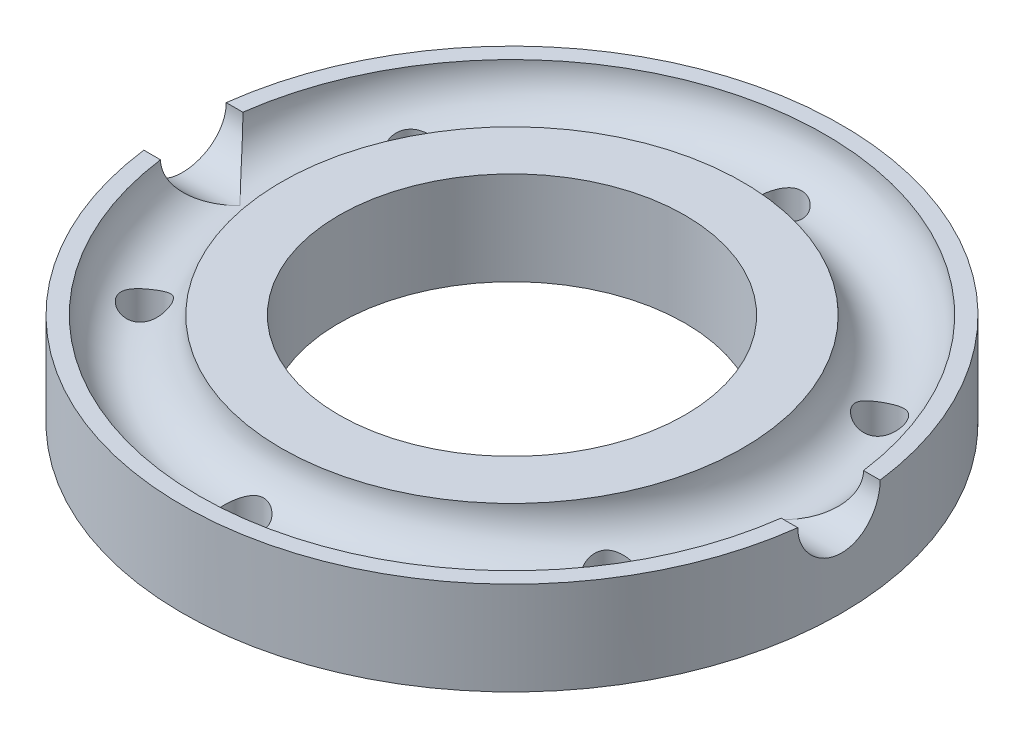
from build123d import *

# Parameters (mm, degrees)
SKETCH1_R           = 10.414
SKETCH1_R_2         = 8.001
BOSS_EXTRUDE1_DEPTH = 4.318
BOSS_EXTRUDE2_START = 4.318
SKETCH2_R           = 15.24
SKETCH2_R_2         = 8.001
BOSS_EXTRUDE2_DEPTH = 4.318
SKETCH3_R           = 1.905
CUT_EXTRUDE1_REACH  = 23.981
SKETCH4_R           = 0.9525
CIRPATTERN1_COUNT   = 6
CUT_EXTRUDE2_START  = -4.318
SKETCH5_R           = 10.414
CUT_EXTRUDE2_DEPTH  = 4.318
CUT_EXTRUDE3_REACH  = 36.35
SKETCH8_R           = 1.905
CIRPATTERN2_COUNT   = 2


with BuildPart() as part:
    # Sketch1 → Boss-Extrude1 (new body)
    with BuildSketch(Plane(origin=(0, 0, 0), x_dir=(1, 0, 0), z_dir=(0, 1, 0))):
        Circle(SKETCH1_R)
        Circle(SKETCH1_R_2, mode=Mode.SUBTRACT)
    extrude(amount=BOSS_EXTRUDE1_DEPTH)

    # Sketch2 → Boss-Extrude2 (add)
    with BuildSketch(Plane.XZ.offset(BOSS_EXTRUDE2_START)):
        Circle(SKETCH2_R)
        Circle(SKETCH2_R_2, mode=Mode.SUBTRACT)
    extrude(amount=-BOSS_EXTRUDE2_DEPTH)

    # Sketch3 → Cut-Revolve1 (revolve, cut)
    with BuildSketch(Plane.XY):
        with Locations((12.573, 0)):
            Circle(SKETCH3_R)
    revolve(axis=Axis((0, 55, 0), (0, -1, 0)), mode=Mode.SUBTRACT)

    # Sketch4 → Cut-Extrude1 (cut, up to next)
    with BuildSketch(Plane(origin=(0, 0, 0), x_dir=(1, 0, 0), z_dir=(0, 1, 0)), mode=Mode.PRIVATE) as cut_extrude1_sk1:
        with Locations((0, 12.446)):
            Circle(SKETCH4_R)
    cut_extrude1_tool1 = extrude(cut_extrude1_sk1.sketch, amount=-CUT_EXTRUDE1_REACH, mode=Mode.PRIVATE) & part.part
    cut_extrude1 = cut_extrude1_tool1.solids().sort_by_distance((0, 0, -12.446))[0]
    add(cut_extrude1, mode=Mode.SUBTRACT)

    # CirPattern1: Cut-Extrude1 ×6 about axis
    cirpattern1_axis = Axis((0, 55, 0), (0, -1, 0))
    for i in range(1, CIRPATTERN1_COUNT):
        add(cut_extrude1.rotate(cirpattern1_axis, i * 360 / CIRPATTERN1_COUNT), mode=Mode.SUBTRACT)

    # Sketch5 → Cut-Extrude2 (cut)
    with BuildSketch(Plane(origin=(0, 4.318, 0), x_dir=(1, 0, 0), z_dir=(0, 1, 0)).offset(CUT_EXTRUDE2_START)):
        Circle(SKETCH5_R)
    extrude(amount=CUT_EXTRUDE2_DEPTH, mode=Mode.SUBTRACT)

    # Sketch8 → Cut-Extrude3 (cut, up to next)
    with BuildSketch(Plane(origin=(15.24, 0, 0), x_dir=(0, 0, -1), z_dir=(1, 0, 0)), mode=Mode.PRIVATE) as cut_extrude3_sk1:
        Circle(SKETCH8_R)
    cut_extrude3_tool1 = extrude(cut_extrude3_sk1.sketch, amount=-CUT_EXTRUDE3_REACH, mode=Mode.PRIVATE) & part.part
    cut_extrude3 = cut_extrude3_tool1.solids().sort_by_distance((15.24, 0, 0))[0]
    add(cut_extrude3, mode=Mode.SUBTRACT)

    # CirPattern2: Cut-Extrude3 ×2 about axis
    cirpattern2_axis = Axis((0, 55, 0), (0, -1, 0))
    for i in range(1, CIRPATTERN2_COUNT):
        add(cut_extrude3.rotate(cirpattern2_axis, i * 360 / CIRPATTERN2_COUNT), mode=Mode.SUBTRACT)


solid = part.part
